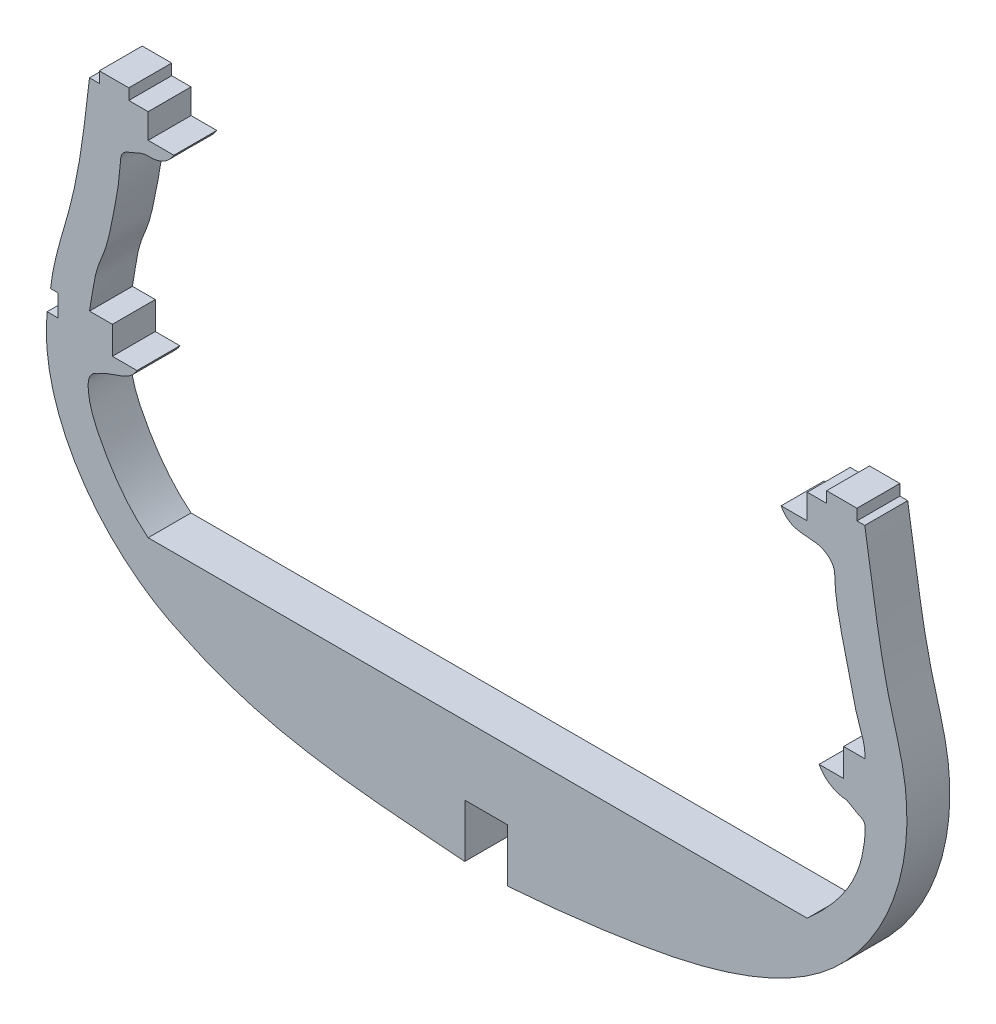
from build123d import *

# Parameters (mm, degrees)
EXTRUDE_1_DEPTH = 8


with BuildPart() as part:
    # 草图1 → 凸台-拉伸1 (new body)
    with BuildSketch(Plane.XY):
        with BuildLine():
            Line((385.357965433, 561.673346746), (262.492458261, 561.673346746))
            add(Edge.make_bspline(
                [(262.492458261, 561.673346746), (258.755227054, 564.690747097), (254.489163017, 570.692581983), (250.958558339, 578.663699118), (251.392954201, 582.911995995), (253.038032269, 583.404225799)],
                knots=[0, 0, 0, 0, 0.550288843, 0.843333433, 1, 1, 1, 1], degree=3))
            add(Edge.make_bspline(
                [(253.038032269, 583.404225799), (255.315281718, 585.087405675), (258.917465666, 584.826242923), (260.41054922, 587.626667325)],
                knots=[0, 0, 0, 0, 1, 1, 1, 1], degree=3))
            Line((260.41054922, 587.626667325), (255.826100279, 587.626667325))
            Line((255.826100279, 587.626667325), (255.826100279, 592.795047007))
            Line((255.826100279, 592.795047007), (251.563528879, 592.795047007))
            add(Edge.make_bspline(
                [(251.563528879, 592.795047007), (252.099280578, 595.332356389), (252.30424139, 599.397528909), (254.870367315, 604.704853199), (256.036177185, 611.101930065), (257.223774455, 616.403011152), (257.350806226, 621.517018547), (260.018224217, 622.50942986), (261.44273548, 623.403583051), (262.884397407, 623.277955683)],
                knots=[0, 0, 0, 0, 0.225136841, 0.340464557, 0.504459531, 0.773880132, 0.846142279, 0.887847448, 1, 1, 1, 1], degree=3))
            add(Edge.make_bspline(
                [(262.884397407, 623.277955683), (265.779471506, 623.335229178), (267.291857283, 625.822468601)],
                knots=[0, 0, 0, 1, 1, 1], degree=2))
            Line((267.291857283, 625.822468601), (262.492458261, 625.822468601))
            Line((262.492458261, 625.822468601), (262.492458261, 630.45711713))
            Line((262.492458261, 630.45711713), (258.885877108, 630.45711713))
            Line((258.885877108, 630.45711713), (258.885877108, 632.501815011))
            Line((258.885877108, 632.501815011), (253.387911696, 632.501815011))
            Line((253.387911696, 632.501815011), (253.387911696, 630.45711713))
            Line((253.387911696, 630.45711713), (251.563528879, 630.45711713))
            add(Edge.make_bspline(
                [(251.563528879, 630.45711713), (250.698671259, 623.153297386), (249.372551029, 610.306461705), (244.876032821, 598.230117075), (244.30036556, 592.795047007)],
                knots=[0, 0, 0, 0, 0.576314622, 1, 1, 1, 1], degree=3))
            Line((244.30036556, 592.795047007), (245.708935211, 592.795047007))
            Line((245.708935211, 592.795047007), (245.708935211, 588.747012602))
            Line((245.708935211, 588.747012602), (243.659941785, 588.747012602))
            add(Edge.make_bspline(
                [(243.659941785, 588.747012602), (241.968151152, 572.019946819), (254.064905505, 555.430773354), (269.202063097, 548.976807751)],
                knots=[0, 0, 0, 0, 1, 1, 1, 1], degree=3))
            add(Edge.make_bspline(
                [(321.524786635, 538.925598683), (303.815006214, 540.356414038), (285.537738305, 540.961956127), (269.202063097, 548.976807751)],
                knots=[0, 0, 0, 0, 1, 1, 1, 1], degree=3))
            Line((321.524786635, 538.925598683), (321.524786635, 548.825598683))
            Line((321.524786635, 548.825598683), (329.523681786, 548.825598683))
            Line((329.523681786, 548.825598683), (329.523681786, 538.925598683))
            add(Edge.make_bspline(
                [(329.523681786, 538.925598683), (336.635065679, 539.455855838), (350.795036594, 540.98434062), (371.450253512, 544.894314569), (390.860581729, 554.149899578), (403.17715419, 572.252526901), (404.919659425, 590.639617898), (398.920276591, 609.258314447), (397.578120519, 621.728272643), (396.084660892, 630.45711713)],
                knots=[0.022562909, 0.022562909, 0.022562909, 0.022562909, 0.169619713, 0.313456669, 0.455553847, 0.599027509, 0.743616146, 0.81734271, 1, 1, 1, 1], degree=3))
            Line((396.084660892, 630.45711713), (394.626288649, 630.45711713))
            Line((394.626288649, 630.45711713), (394.626288649, 632.501815011))
            Line((394.626288649, 632.501815011), (388.969627714, 632.501815011))
            Line((388.969627714, 632.501815011), (388.969627714, 630.45711713))
            Line((388.969627714, 630.45711713), (385.357965433, 630.45711713))
            Line((385.357965433, 630.45711713), (385.357965433, 625.822468601))
            Line((385.357965433, 625.822468601), (380.484636312, 625.822468601))
            add(Edge.make_bspline(
                [(390.468186764, 620.004547134), (390.318441736, 621.540164676), (388.291406594, 623.105959301), (384.266764698, 623.301339884), (381.681013657, 623.566294511), (380.484636312, 625.822468601)],
                knots=[0, 0, 0, 0, 0.359484701, 0.544095806, 1, 1, 1, 1], degree=3))
            add(Edge.make_bspline(
                [(396.084660892, 592.795047007), (396.273338821, 595.035601852), (394.491326644, 598.649653656), (392.754617954, 607.78086099), (390.506088052, 614.555885201), (390.468186764, 620.004547134)],
                knots=[0, 0, 0, 0, 0.233822493, 0.424152047, 1, 1, 1, 1], degree=3))
            Line((396.084660892, 592.795047007), (392.143349898, 592.795047007))
            Line((392.143349898, 592.795047007), (392.143349898, 587.626667325))
            Line((392.143349898, 587.626667325), (387.568865956, 587.626667325))
            add(Edge.make_bspline(
                [(392.787643411, 584.409050029), (389.209022339, 584.691860965), (387.568865956, 587.626667325)],
                knots=[0, 0, 0, 1, 1, 1], degree=2))
            add(Edge.make_bspline(
                [(385.357965433, 561.673346746), (390.860473795, 566.695743735), (395.811948725, 572.387483653), (396.250899198, 583.226521225), (395.181143378, 582.798789337), (392.787643411, 584.409050029)],
                knots=[0, 0, 0, 0, 0.778226287, 0.85369222, 1, 1, 1, 1], degree=3))
        make_face()
    extrude(amount=EXTRUDE_1_DEPTH)


solid = part.part
